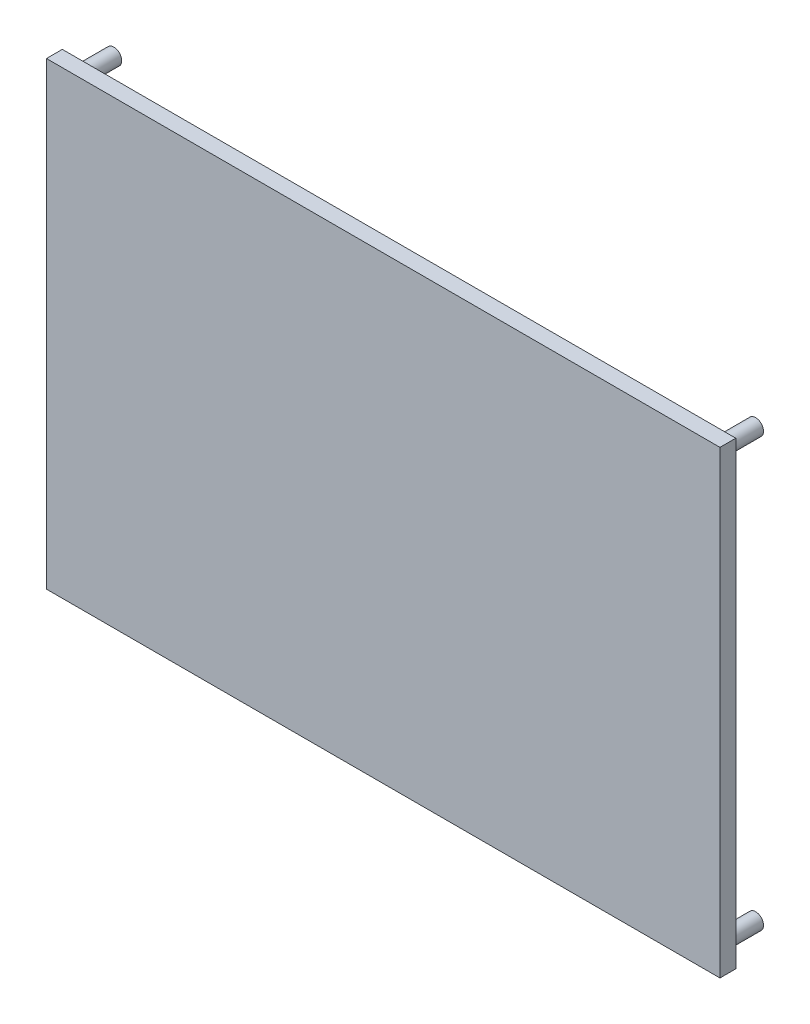
from build123d import *

# Parameters (mm, degrees)
SKETCH1_W           = 85
SKETCH1_H           = 58
BOSS_EXTRUDE1_DEPTH = 2
SKETCH2_R           = 1
BOSS_EXTRUDE3_DEPTH = 6.5


with BuildPart() as part:
    # Sketch1 → Boss-Extrude1 (new body)
    with BuildSketch(Plane.XY):
        with Locations((-42.5, 29)):
            Rectangle(SKETCH1_W, SKETCH1_H)
    extrude(amount=BOSS_EXTRUDE1_DEPTH)

    # Sketch2 → Boss-Extrude3 (add)
    with BuildSketch(Plane.XY.offset(2)):
        with Locations((-83, 56)):
            Circle(SKETCH2_R)
        with Locations((-2, 56)):
            Circle(SKETCH2_R)
        with Locations((-83, 2)):
            Circle(SKETCH2_R)
        with Locations((-2, 2)):
            Circle(SKETCH2_R)
    extrude(amount=-BOSS_EXTRUDE3_DEPTH)


solid = part.part
